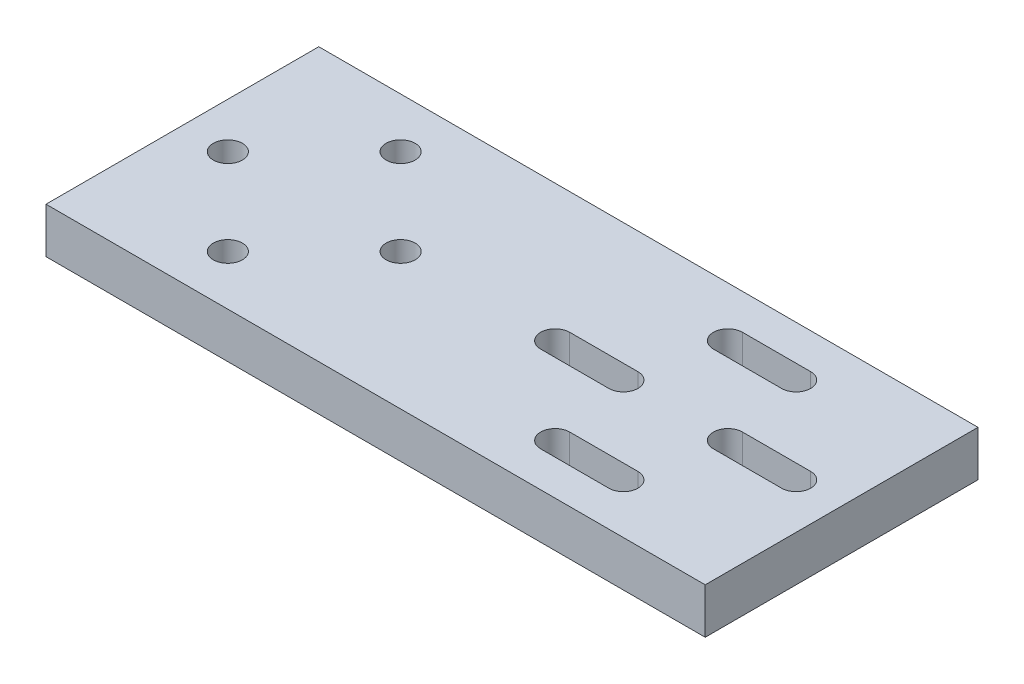
from build123d import *

# Parameters (mm, degrees)
SKETCH2_W           = 65
SKETCH2_H           = 30
BOSS_EXTRUDE1_DEPTH = 5
SKETCH3_R           = 1.6
CUT_EXTRUDE1_DEPTH  = 37.142080737
SKETCH5_W           = 30
SKETCH5_H           = 5
BOSS_EXTRUDE2_DEPTH = 7.5
CUT_EXTRUDE2_DEPTH  = 10


with BuildPart() as part:
    # Sketch2 → Boss-Extrude1 (new body)
    with BuildSketch(Plane(origin=(0, 0, 0), x_dir=(1, 0, 0), z_dir=(0, 1, 0))):
        Rectangle(SKETCH2_W, SKETCH2_H)
    extrude(amount=BOSS_EXTRUDE1_DEPTH)

    # Sketch3 → Cut-Extrude1 (cut, through all)
    with BuildSketch(Plane(origin=(0, 5, 0), x_dir=(1, 0, 0), z_dir=(0, 1, 0))):
        with Locations(Location((-27.5, 0, 0), (0, 0, 270))):
            Circle(SKETCH3_R)
        with Locations(Location((-18, 9.5, 0), (0, 0, 270))):
            Circle(SKETCH3_R)
        with Locations(Location((-8.5, 0, 0), (0, 0, 270))):
            Circle(SKETCH3_R)
        with Locations(Location((-18, -9.5, 0), (0, 0, 270))):
            Circle(SKETCH3_R)
        with Locations(Location((18, -9.5, 0), (0, 0, 90))):
            Circle(SKETCH3_R)
        with Locations(Location((27.5, 0, 0), (0, 0, 90))):
            Circle(SKETCH3_R)
        with Locations(Location((18, 9.5, 0), (0, 0, 90))):
            Circle(SKETCH3_R)
        with Locations(Location((8.5, 0, 0), (0, 0, 90))):
            Circle(SKETCH3_R)
    extrude(amount=-CUT_EXTRUDE1_DEPTH, mode=Mode.SUBTRACT)

    # Sketch5 → Boss-Extrude2 (add)
    with BuildSketch(Plane(origin=(32.5, 0, 0), x_dir=(0, 0, -1), z_dir=(1, 0, 0))):
        with Locations((0, 2.5)):
            Rectangle(SKETCH5_W, SKETCH5_H)
    extrude(amount=BOSS_EXTRUDE2_DEPTH)

    # Sketch4 → Cut-Extrude2 (cut)
    with BuildSketch(Plane(origin=(0, 5, 0), x_dir=(1, 0, 0), z_dir=(0, 1, 0))):
        with BuildLine():
            Line((8.5, 1.6), (16, 1.6))
            ThreePointArc((16, 1.6), (17.6, 0), (16, -1.6))
            Line((16, -1.6), (8.5, -1.6))
            ThreePointArc((8.5, -1.6), (6.9, 0), (8.5, 1.6))
        make_face()
        with BuildLine():
            Line((27.5, 1.6), (35, 1.6))
            ThreePointArc((35, 1.6), (36.6, 0), (35, -1.6))
            Line((35, -1.6), (27.5, -1.6))
            ThreePointArc((27.5, -1.6), (25.9, 0), (27.5, 1.6))
        make_face()
        with BuildLine():
            Line((18, -7.9), (25.5, -7.9))
            ThreePointArc((25.5, -7.9), (27.1, -9.5), (25.5, -11.1))
            Line((25.5, -11.1), (18, -11.1))
            ThreePointArc((18, -11.1), (16.4, -9.5), (18, -7.9))
        make_face()
        with BuildLine():
            Line((18, 11.1), (25.5, 11.1))
            ThreePointArc((25.5, 11.1), (27.1, 9.5), (25.5, 7.9))
            Line((25.5, 7.9), (18, 7.9))
            ThreePointArc((18, 7.9), (16.4, 9.5), (18, 11.1))
        make_face()
    extrude(amount=-CUT_EXTRUDE2_DEPTH, mode=Mode.SUBTRACT)


solid = part.part
